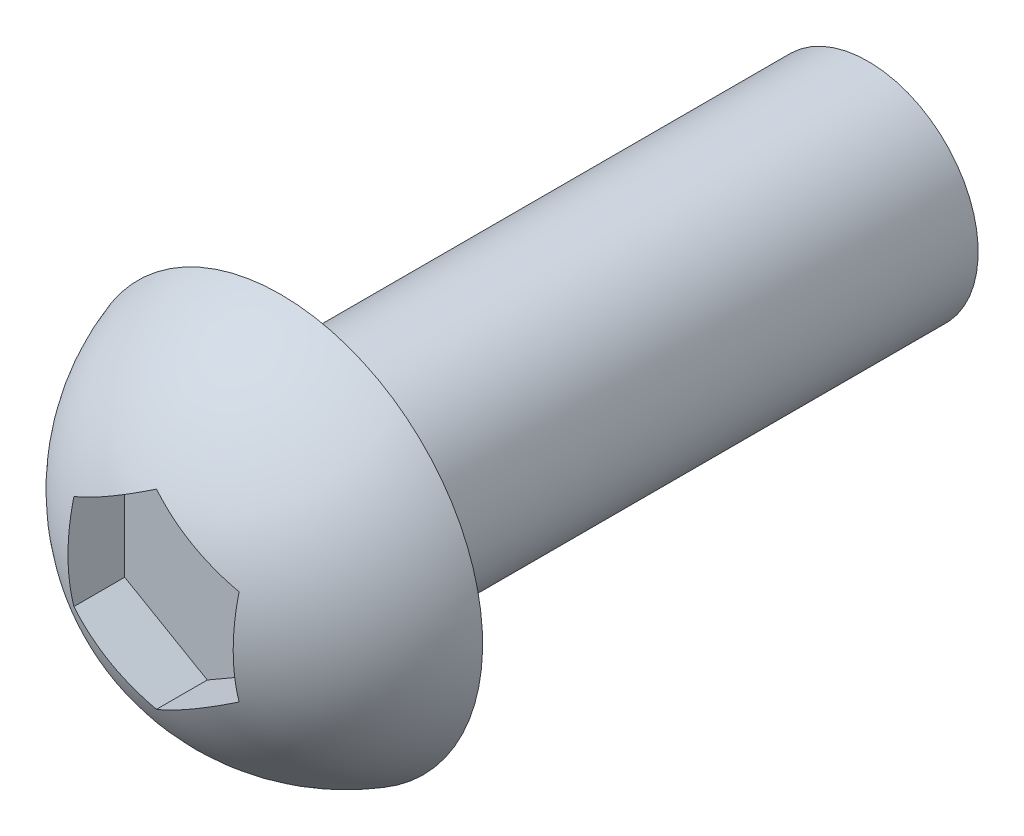
from build123d import *

# Parameters (mm, degrees)
CUT_EXTRUDE1_START = 5
CUT_EXTRUDE1_DEPTH = 1


with BuildPart() as part:
    # Sketch1 → Revolve1 (revolve)
    with BuildSketch(Plane.YZ, mode=Mode.PRIVATE) as revolve1_sk:
        with BuildLine():
            Line((0, -5), (1.5, -5))
            Line((1.5, -5), (1.5, 3))
            Line((1.5, 3), (2.75, 3))
            ThreePointArc((2.75, 3), (1.700183814, 4.447127744), (0, 5))
            Line((0, 5), (0, 3))
            Line((0, 3), (0, -5))
        make_face()
    revolve(revolve1_sk.sketch.rotate(Axis((0, 0, 3), (0, 0, 1)), 90), axis=Axis((0, 0, 3), (0, 0, 1)))

    # Sketch2 → Cut-Extrude1 (cut)
    with BuildSketch(Plane(origin=(0, 0, 0), x_dir=(0, 1, 0), z_dir=(0, 0, 1)).offset(CUT_EXTRUDE1_START)):
        Polygon((1.299038106, 0), (0.649519053, 1.125), (-0.649519053, 1.125), (-1.299038106, 0), (-0.649519053, -1.125), (0.649519053, -1.125), align=None)
    extrude(amount=-CUT_EXTRUDE1_DEPTH, mode=Mode.SUBTRACT)


solid = part.part
